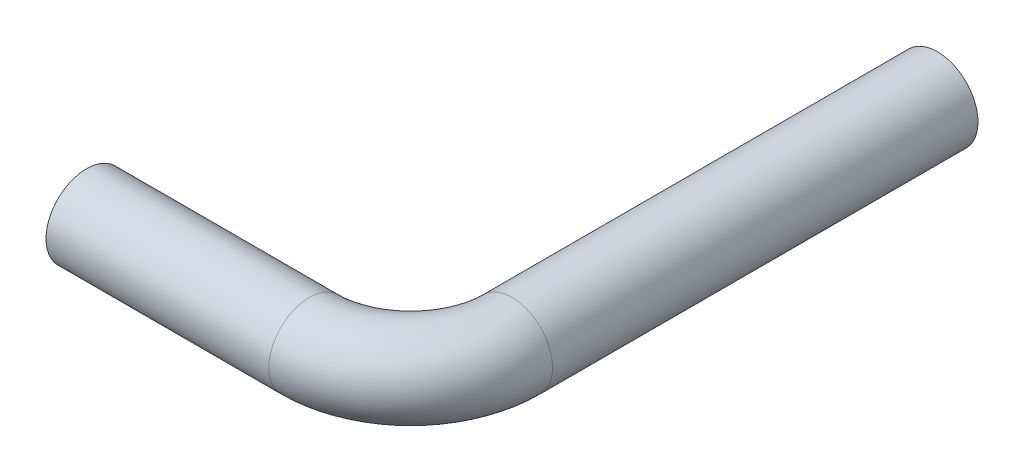
from build123d import *

# Parameters (mm, degrees)
TUBE_PROFILE_R   = 4
TUBE_PROFILE_R_2 = 3


with BuildPart() as part:
    # Tube: sweep along a curve in space
    with BuildLine() as tube_path:
        Line((148, 21, 95), (170, 21, 95))
        ThreePointArc((180, 21, 85), (177.071067812, 21, 92.071067812), (170, 21, 95))
        Line((180, 21, 85), (180, 21, 43))
    # Tube profile (on start of the path) → Tube (sweep)
    with BuildSketch(Plane(origin=(148, 21, 95), x_dir=(0, 0, 1), z_dir=(1, 0, 0))):
        Circle(TUBE_PROFILE_R)
        Circle(TUBE_PROFILE_R_2, mode=Mode.SUBTRACT)
    sweep(path=tube_path.line)


solid = part.part
